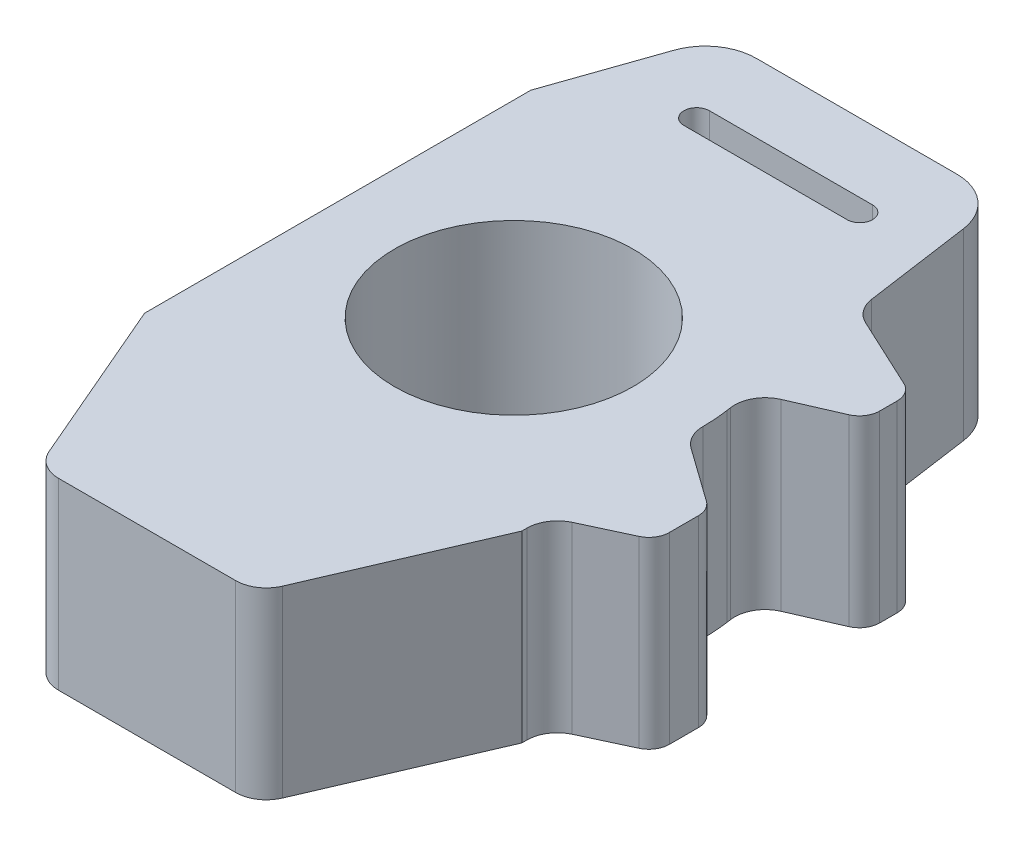
from build123d import *

# Parameters (mm, degrees)
BOSS_EXTRUDE1_DEPTH      = 28.575
BOSS_EXTRUDE1_DEPTH_BACK = 28.575
SKETCH2_R                = 37.1475
CUT_EXTRUDE1_DEPTH       = 152.764361406
CUT_EXTRUDE2_DEPTH       = 152.764361406


with BuildPart() as part:
    # Sketch1 → Boss-Extrude1 (new, two sides: drawn at the far end of the back side and taken through both)
    with BuildSketch(Plane(origin=(0, 0, 0), x_dir=(1, 0, 0), z_dir=(0, 1, 0)).offset(-BOSS_EXTRUDE1_DEPTH_BACK)):
        with BuildLine():
            Line((-58.7375, -56.215922718), (-36.318524201, -108.376210733))
            ThreePointArc((-36.318524201, -108.376210733), (-32.806864724, -112.569580799), (-27.567594628, -114.13998))
            Line((-27.567594628, -114.13998), (27.567594628, -114.13998))
            ThreePointArc((27.567594628, -114.13998), (32.806864724, -112.569580799), (36.318524201, -108.376210733))
            Line((36.318524201, -108.376210733), (58.7375, -56.215922718))
            Line((58.7375, -56.215922718), (58.7375, -54.665315944))
            ThreePointArc((58.7375, -54.665315944), (60.229196479, -49.547537174), (64.237061057, -46.032734272))
            Line((64.237061057, -46.032734272), (78.421163742, -39.418578566))
            ThreePointArc((78.421163742, -39.418578566), (81.09307346, -37.075376632), (82.087537779, -33.663524119))
            Line((82.087537779, -33.663524119), (82.087537779, -24.620694942))
            ThreePointArc((82.087537779, -24.620694942), (81.383346428, -21.714263332), (79.426956769, -19.452456605))
            Line((79.426956769, -19.452456605), (62.728014827, -7.531684093))
            ThreePointArc((62.728014827, -7.531684093), (59.800488167, -4.152656806), (58.737193082, 0.189881775))
            ThreePointArc((58.737193082, 0.189881775), (58.584774766, 4.232974359), (58.154386408, 8.255982544))
            Line((58.154386408, 8.255982544), (57.969746696, 9.5565678))
            ThreePointArc((57.969746696, 9.5565678), (59.08262132, 15.536896429), (63.58784972, 19.624161713))
            Line((63.58784972, 19.624161713), (78.279096456, 26.040632326))
            ThreePointArc((78.279096456, 26.040632326), (81.050794671, 28.382496216), (82.087537779, 31.859822947))
            Line((82.087537779, 31.859822947), (82.087537779, 37.284206824))
            ThreePointArc((82.087537779, 37.284206824), (81.09307346, 40.696059337), (78.421163742, 43.039261272))
            Line((78.421163742, 43.039261272), (56.108767451, 53.443702534))
            ThreePointArc((56.108767451, 53.443702534), (52.481431722, 56.405246839), (50.703765355, 60.737476226))
            Line((50.703765355, 60.737476226), (45.968035191, 94.095526633))
            ThreePointArc((45.968035191, 94.095526633), (40.657193823, 103.852471221), (30.25063346, 107.73918))
            Line((30.25063346, 107.73918), (-32.2469722, 107.73918))
            ThreePointArc((-32.2469722, 107.73918), (-41.44482588, 104.803079207), (-47.240370837, 97.080847739))
            Line((-47.240370837, 97.080847739), (-58.7375, 64.036565575))
            Line((-58.7375, 64.036565575), (-58.7375, -56.215922718))
        make_face()
    extrude(amount=BOSS_EXTRUDE1_DEPTH + BOSS_EXTRUDE1_DEPTH_BACK)

    # Sketch2 → Cut-Extrude1 (cut, through all)
    with BuildSketch(Plane(origin=(0, 28.575, 0), x_dir=(1, 0, 0), z_dir=(0, 1, 0))):
        Circle(SKETCH2_R)
    extrude(amount=-CUT_EXTRUDE1_DEPTH, mode=Mode.SUBTRACT)

    # Sketch5 → Cut-Extrude2 (cut, through all)
    with BuildSketch(Plane.XZ.offset(28.575)):
        with BuildLine():
            Line((-25.4, -86.31428), (25.4, -86.31428))
            ThreePointArc((25.4, -86.31428), (29.3751, -82.33918), (25.4, -78.36408))
            Line((25.4, -78.36408), (-25.4, -78.36408))
            ThreePointArc((-25.4, -78.36408), (-29.3751, -82.33918), (-25.4, -86.31428))
        make_face()
    extrude(amount=-CUT_EXTRUDE2_DEPTH, mode=Mode.SUBTRACT)


solid = part.part
